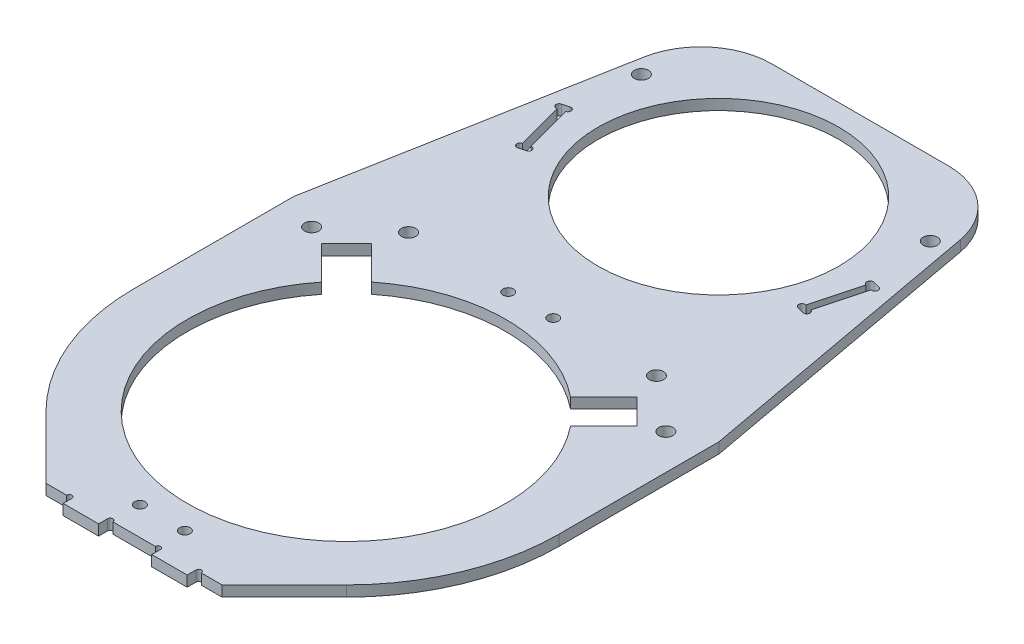
from build123d import *

# Parameters (mm, degrees)
SKETCH_1_R          = 1.5
SKETCH_1_R_2        = 45
EXTRUDE_1_DEPTH     = 3
SKETCH_2_R          = 34
SKETCH_2_R_2        = 2
CUT_EXTRUDE_1_DEPTH = 157.95222203
SKETCH_3_W          = 10
SKETCH_3_H          = 3
EXTRUDE_2_DEPTH     = 2.5
SKETCH_5_R          = 0.75
CUT_EXTRUDE_2_DEPTH = 157.95222203
SKETCH_8_R          = 0.9
CUT_EXTRUDE_3_DEPTH = 157.95222203


with BuildPart() as part:
    # 草图1 → Extrude 1 (new body)
    with BuildSketch(Plane(origin=(0, 0, 0), x_dir=(1, 0, 0), z_dir=(0, 1, 0))):
        with BuildLine():
            Line((-60, 24.852813742), (-60, -24.852813742))
            Line((-60, -24.852813742), (-24.852813742, -60))
            Line((-24.852813742, -60), (24.852813742, -60))
            Line((24.852813742, -60), (60, -24.852813742))
            Line((60, -24.852813742), (60, 24.852813742))
            Line((60, 24.852813742), (60, 45.147186258))
            Line((60, 45.147186258), (44.671002135, 128.6127102))
            ThreePointArc((44.671002135, 128.6127102), (37.801285013, 140.366427757), (25, 145))
            Line((25, 145), (-25, 145))
            ThreePointArc((-25, 145), (-37.801285013, 140.366427757), (-44.671002135, 128.6127102))
            Line((-44.671002135, 128.6127102), (-60, 45.147186258))
            Line((-60, 45.147186258), (-60, 24.852813742))
        make_face()
        with Locations(Location((-6.35, 52, 0), (0, 0, 270))):
            Circle(SKETCH_1_R, mode=Mode.SUBTRACT)
        with Locations(Location((6.35, 52, 0), (0, 0, 270))):
            Circle(SKETCH_1_R, mode=Mode.SUBTRACT)
        with Locations(Location((6.35, -52, 0), (0, 0, 90))):
            Circle(SKETCH_1_R, mode=Mode.SUBTRACT)
        with Locations(Location((-6.35, -52, 0), (0, 0, 90))):
            Circle(SKETCH_1_R, mode=Mode.SUBTRACT)
        with Locations(Location((0, 0, 0), (0, 0, 270))):
            Circle(SKETCH_1_R_2, mode=Mode.SUBTRACT)
    extrude(amount=EXTRUDE_1_DEPTH)

    # 草图2 → 切除-拉伸1 (cut, through all)
    with BuildSketch(Plane(origin=(0, 3, 0), x_dir=(1, 0, 0), z_dir=(0, 1, 0))):
        with Locations(Location((0, 105, 0), (0, 0, 270))):
            Circle(SKETCH_2_R)
        with Locations(Location((-35, 52.5, 0), (0, 0, 270))):
            Circle(SKETCH_2_R_2)
        with Locations(Location((35, 52.5, 0), (0, 0, 270))):
            Circle(SKETCH_2_R_2)
        with Locations(Location((40.783850417, 124.017821778, 0), (0, 0, 270))):
            Circle(SKETCH_2_R_2)
        with Locations(Location((-40.783850417, 124.017821778, 0), (0, 0, 90))):
            Circle(SKETCH_2_R_2)
        with Locations(Location((-50, 40.147186258, 0), (0, 0, 270))):
            Circle(SKETCH_2_R_2)
        with Locations(Location((50, 40.147186258, 0), (0, 0, 90))):
            Circle(SKETCH_2_R_2)
        Polygon((28.087242696, 35.158310508), (35.158310508, 28.087242696), (44.547727215, 37.476659403), (37.476659403, 44.547727215), align=None)
        Polygon((-37.476659403, 44.547727215), (-44.547727215, 37.476659403), (-35.158310508, 28.087242696), (-28.087242696, 35.158310508), align=None)
    extrude(amount=-CUT_EXTRUDE_1_DEPTH, mode=Mode.SUBTRACT)

    # 草图3 → 凸台-拉伸2 (add)
    with BuildSketch(Plane.XY.offset(60)):
        with Locations((-12.5, 1.5)):
            Rectangle(SKETCH_3_W, SKETCH_3_H)
        with Locations((12.5, 1.5)):
            Rectangle(SKETCH_3_W, SKETCH_3_H)
    extrude(amount=EXTRUDE_2_DEPTH)

    # 草图5 → 切除-拉伸2 (cut, through all)
    with BuildSketch(Plane(origin=(0, 3, 0), x_dir=(1, 0, 0), z_dir=(0, 1, 0))):
        with Locations((-18.25, -60)):
            Circle(SKETCH_5_R)
        with Locations((-6.75, -60)):
            Circle(SKETCH_5_R)
        with Locations((6.75, -60)):
            Circle(SKETCH_5_R)
        with Locations((18.25, -60)):
            Circle(SKETCH_5_R)
        Polygon((-44.794179278, 105.501282313), (-40.264845988, 88.597580353), (-38.332994336, 89.115218444), (-42.862327625, 106.018920404), align=None)
        Polygon((42.862327625, 106.018920404), (38.332994336, 89.115218444), (40.264845988, 88.597580353), (44.794179278, 105.501282313), align=None)
        with BuildLine():
            Line((-60, 0), (-60, -24.852813742))
            Line((-60, -24.852813742), (-42.426406871, -42.426406871))
            ThreePointArc((-42.426406871, -42.426406871), (-55.432771951, -22.961005942), (-60, 0))
        make_face()
        with BuildLine():
            Line((60, -24.852813742), (42.426406871, -42.426406871))
            ThreePointArc((42.426406871, -42.426406871), (55.432771951, -22.961005942), (60, 0))
            Line((60, 0), (60, -24.852813742))
        make_face()
    extrude(amount=-CUT_EXTRUDE_2_DEPTH, mode=Mode.SUBTRACT)

    # 草图8 → 切除-拉伸3 (cut, through all)
    with BuildSketch(Plane(origin=(0, 3, 0), x_dir=(1, 0, 0), z_dir=(0, 1, 0))):
        with Locations((-44.561242137, 104.63194907)):
            Circle(SKETCH_8_R)
        with Locations((-42.629390484, 105.14958716)):
            Circle(SKETCH_8_R)
        with Locations((-38.565931476, 89.984551687)):
            Circle(SKETCH_8_R)
        with Locations((-40.497783129, 89.466913597)):
            Circle(SKETCH_8_R)
        with Locations((40.497783129, 89.466913597)):
            Circle(SKETCH_8_R)
        with Locations((38.565931476, 89.984551687)):
            Circle(SKETCH_8_R)
        with Locations((42.629390484, 105.14958716)):
            Circle(SKETCH_8_R)
        with Locations((44.561242137, 104.63194907)):
            Circle(SKETCH_8_R)
    extrude(amount=-CUT_EXTRUDE_3_DEPTH, mode=Mode.SUBTRACT)


solid = part.part
